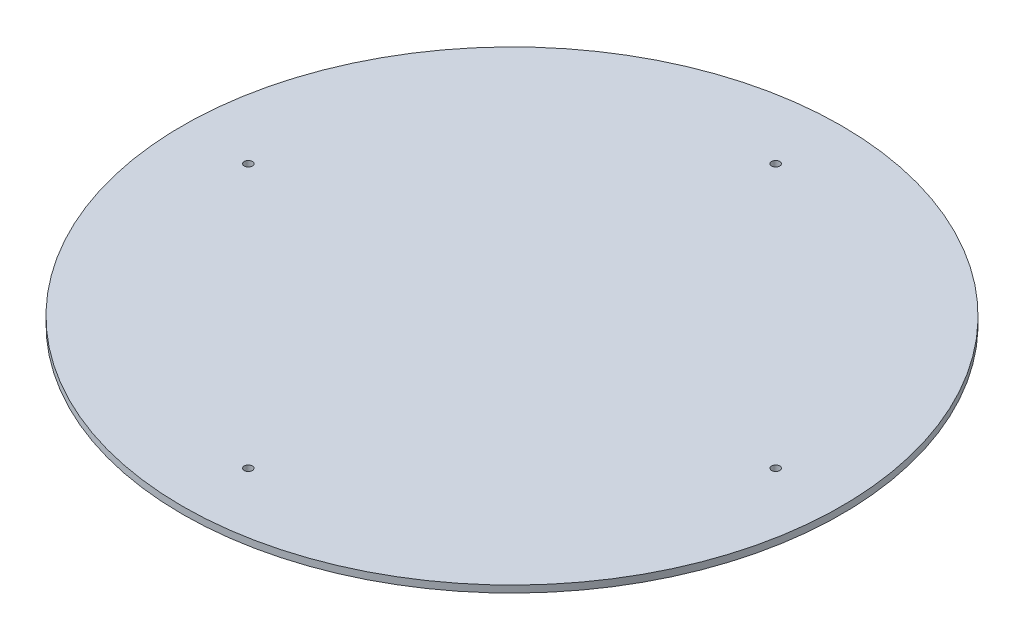
from build123d import *

# Parameters (mm, degrees)
SKETCH1_R             = 285
BOSS_EXTRUDE1_DEPTH   = 6
CROQUIS2_R            = 3.5
CORTAR_EXTRUIR1_DEPTH = 404.095522178


with BuildPart() as part:
    # Sketch1 → Boss-Extrude1 (new body)
    with BuildSketch(Plane(origin=(0, 0, 0), x_dir=(1, 0, 0), z_dir=(0, 1, 0))):
        with Locations(Location((0, 0, 0), (0, 0, 270))):
            Circle(SKETCH1_R)
    extrude(amount=BOSS_EXTRUDE1_DEPTH)

    # Croquis2 → Cortar-Extruir1 (cut, through all)
    with BuildSketch(Plane(origin=(0, 6, 0), x_dir=(1, 0, 0), z_dir=(0, 1, 0))):
        with Locations(Location((228.04, 0, 0), (0, 0, 270))):
            Circle(CROQUIS2_R)
        with Locations(Location((0, -228.04, 0), (0, 0, 270))):
            Circle(CROQUIS2_R)
        with Locations(Location((-228.04, 0, 0), (0, 0, 270))):
            Circle(CROQUIS2_R)
        with Locations(Location((0, 228.04, 0), (0, 0, 270))):
            Circle(CROQUIS2_R)
    extrude(amount=-CORTAR_EXTRUIR1_DEPTH, mode=Mode.SUBTRACT)


solid = part.part
